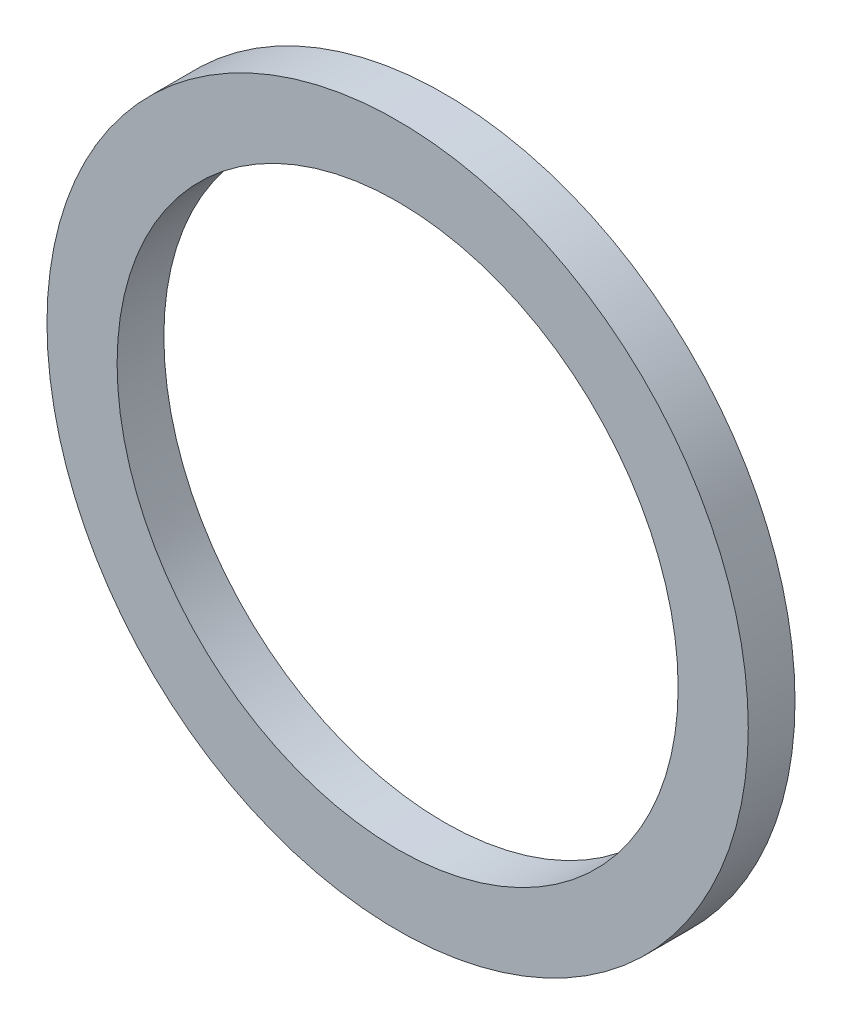
from build123d import *

# Parameters (mm, degrees)
CROQUIS1_R              = 7.5
CROQUIS1_R_2            = 6
SALIENTE_EXTRUIR1_DEPTH = 1


with BuildPart() as part:
    # Croquis1 → Saliente-Extruir1 (new body)
    with BuildSketch(Plane.XY):
        Circle(CROQUIS1_R)
        Circle(CROQUIS1_R_2, mode=Mode.SUBTRACT)
    extrude(amount=SALIENTE_EXTRUIR1_DEPTH)


solid = part.part
